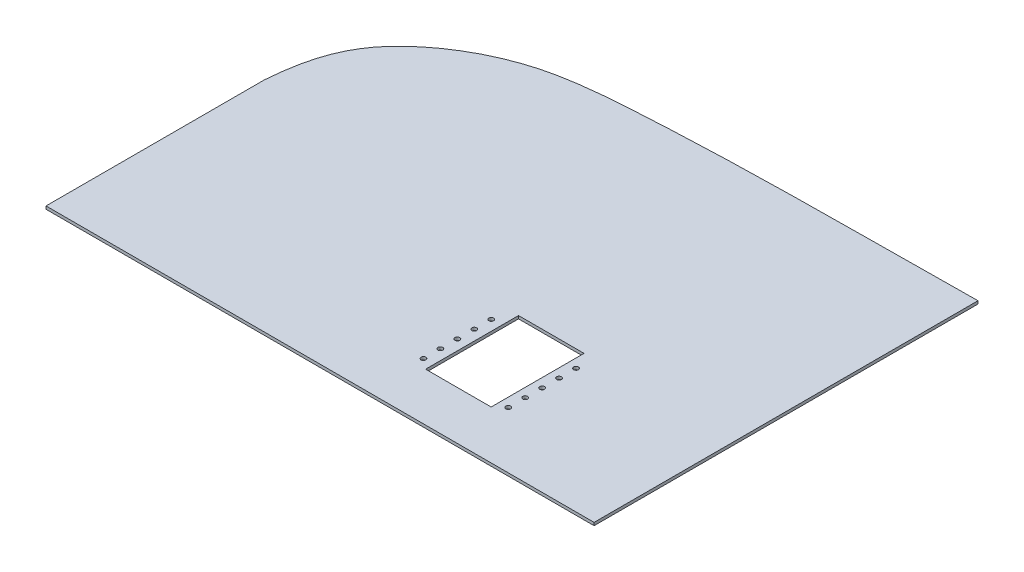
from build123d import *

# Parameters (mm, degrees)
CROQUIS1_R              = 2
CROQUIS1_W              = 54.1
CROQUIS1_H              = 76.7
SALIENTE_EXTRUIR1_DEPTH = 2.4


with BuildPart() as part:
    # Croquis1 → Saliente-Extruir1 (new body)
    with BuildSketch(Plane(origin=(0, 0, 0), x_dir=(1, 0, 0), z_dir=(0, 1, 0))):
        with BuildLine():
            Line((-226.279027723, 0), (226.279027723, 0))
            Line((226.279027723, 0), (226.279027723, 317))
            add(Edge.make_bspline(
                [(226.279027723, 317), (126.058596011, 315.530489859), (25.957083457, 316.912644391), (-74, 309.175657787)],
                knots=[0, 0, 0, 0, 1, 1, 1, 1], degree=3))
            add(Edge.make_bspline(
                [(-226.279027723, 180), (-223.667205932, 215.476583649), (-213.411911356, 241.728935898), (-180.591001989, 273.897889753), (-156.350341436, 289.269961958), (-113.067752708, 305.04715057), (-89.421541744, 307.637409523), (-74, 309.175657787)],
                knots=[0, 0, 0, 0, 0.358064893, 0.430060637, 0.687746689, 0.747961701, 1, 1, 1, 1], degree=3))
            Line((-226.279027723, 180), (-226.279027723, 0))
        make_face()
        with Locations(Location((38.679027723, 102.7, 0), (0, 0, 270))):
            Circle(CROQUIS1_R, mode=Mode.SUBTRACT)
        with Locations(Location((108.679027723, 102.7, 0), (0, 0, 270))):
            Circle(CROQUIS1_R, mode=Mode.SUBTRACT)
        with Locations(Location((108.679027723, 88.7, 0), (0, 0, 270))):
            Circle(CROQUIS1_R, mode=Mode.SUBTRACT)
        with Locations(Location((108.679027723, 74.7, 0), (0, 0, 270))):
            Circle(CROQUIS1_R, mode=Mode.SUBTRACT)
        with Locations(Location((108.679027723, 60.7, 0), (0, 0, 270))):
            Circle(CROQUIS1_R, mode=Mode.SUBTRACT)
        with Locations(Location((108.679027723, 46.7, 0), (0, 0, 270))):
            Circle(CROQUIS1_R, mode=Mode.SUBTRACT)
        with Locations(Location((38.679027723, 88.7, 0), (0, 0, 270))):
            Circle(CROQUIS1_R, mode=Mode.SUBTRACT)
        with Locations(Location((38.679027723, 74.7, 0), (0, 0, 270))):
            Circle(CROQUIS1_R, mode=Mode.SUBTRACT)
        with Locations(Location((38.679027723, 60.7, 0), (0, 0, 270))):
            Circle(CROQUIS1_R, mode=Mode.SUBTRACT)
        with Locations(Location((38.679027723, 46.7, 0), (0, 0, 270))):
            Circle(CROQUIS1_R, mode=Mode.SUBTRACT)
        with Locations((74.229027723, 78.35)):
            Rectangle(CROQUIS1_W, CROQUIS1_H, mode=Mode.SUBTRACT)
    extrude(amount=SALIENTE_EXTRUIR1_DEPTH)


solid = part.part
